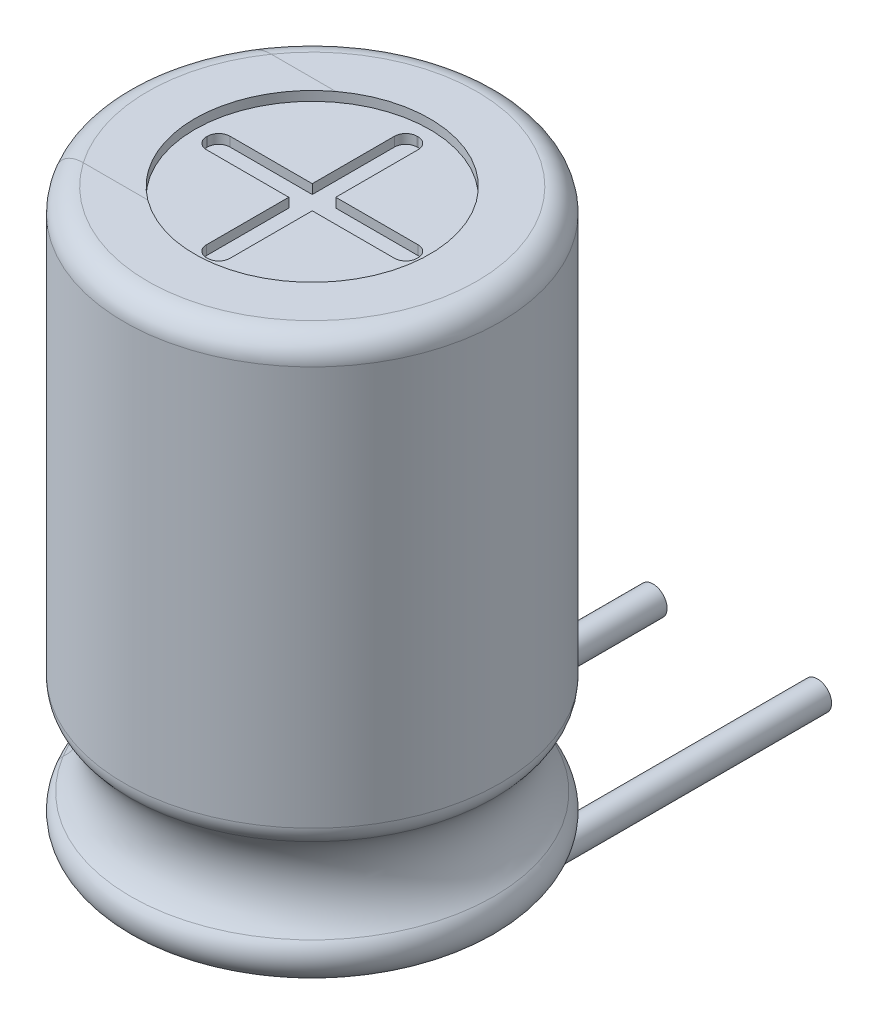
from build123d import *

# Parameters (mm, degrees)
SKETCH_3_R          = 2.5
CUT_EXTRUDE_1_DEPTH = 0.2
CUT_EXTRUDE_2_DEPTH = 0.2
CUT_EXTRUDE_START   = -0.2
SKETCH_5_R          = 2.5
CUT_EXTRUDE_3_DEPTH = 0.2
SKETCH_11_R         = 0.3


with BuildPart() as part:
    # Эскиз2 → Повернуть1 (revolve)
    with BuildSketch(Plane.XY):
        with BuildLine():
            Line((0, 0), (3.5, 0))
            ThreePointArc((3.5, 0), (3.853553391, 0.146446609), (4, 0.5))
            ThreePointArc((4, 0.5), (3.964238345, 0.685695338), (3.862068966, 0.844827586))
            ThreePointArc((3.862068966, 0.844827586), (3.5, 1.75), (3.862068966, 2.655172414))
            ThreePointArc((3.862068966, 2.655172414), (3.964238345, 2.814304662), (4, 3))
            Line((4, 3), (4, 11.5))
            ThreePointArc((4, 11.5), (3.853553391, 11.853553391), (3.5, 12))
            Line((3.5, 12), (0, 12))
            Line((0, 12), (0, 0))
        make_face()
    revolve(axis=Axis((0, 0, 0), (0, 1, 0)))

    # Эскиз3 → Вырез-Вытянуть1 (cut)
    with BuildSketch(Plane(origin=(0, 12, 0), x_dir=(1, 0, 0), z_dir=(0, 1, 0))):
        with Locations(Location((0, 0, 0), (0, 0, 180))):
            Circle(SKETCH_3_R)
    extrude(amount=-CUT_EXTRUDE_1_DEPTH, mode=Mode.SUBTRACT)

    # Эскиз4 → Вырез-Вытянуть2 (cut)
    with BuildSketch(Plane(origin=(0, 11.8, 0), x_dir=(1, 0, 0), z_dir=(0, 1, 0))):
        with BuildLine():
            Line((-0.25, -0.25), (-0.25, -2))
            ThreePointArc((-0.25, -2), (-0.179705627, -2.169705627), (-0.01, -2.24))
            Line((-0.01, -2.24), (0.01, -2.24))
            ThreePointArc((0.01, -2.24), (0.179705627, -2.169705627), (0.25, -2))
            Line((0.25, -2), (0.25, -0.25))
            Line((0.25, -0.25), (2, -0.25))
            ThreePointArc((2, -0.25), (2.169705627, -0.179705627), (2.24, -0.01))
            Line((2.24, -0.01), (2.24, 0.01))
            ThreePointArc((2.24, 0.01), (2.169705627, 0.179705627), (2, 0.25))
            Line((2, 0.25), (0.25, 0.25))
            Line((0.25, 0.25), (0.25, 2))
            ThreePointArc((0.25, 2), (0.179705627, 2.169705627), (0.01, 2.24))
            Line((0.01, 2.24), (-0.01, 2.24))
            ThreePointArc((-0.01, 2.24), (-0.179705627, 2.169705627), (-0.25, 2))
            Line((-0.25, 2), (-0.25, 0.25))
            Line((-0.25, 0.25), (-2, 0.25))
            ThreePointArc((-2, 0.25), (-2.169705627, 0.179705627), (-2.24, 0.01))
            Line((-2.24, 0.01), (-2.24, -0.01))
            ThreePointArc((-2.24, -0.01), (-2.169705627, -0.179705627), (-2, -0.25))
            Line((-2, -0.25), (-0.25, -0.25))
        make_face()
    extrude(amount=-CUT_EXTRUDE_2_DEPTH, mode=Mode.SUBTRACT)

    # Эскиз5 → Вырез-Вытянуть3 (cut)
    with BuildSketch(Plane.XZ.offset(CUT_EXTRUDE_START)):
        with Locations(Location((0, 0, 0), (0, 0, 180))):
            Circle(SKETCH_5_R)
    extrude(amount=CUT_EXTRUDE_3_DEPTH, mode=Mode.SUBTRACT)


with BuildPart() as body_2:
    # По траектории1: sweep along a path in Эскиз10
    with BuildLine(Plane(origin=(1.75, 0, 0), x_dir=(0, 0, -1), z_dir=(1, 0, 0))) as sweep_1_path:
        Line((0, 0.2), (0, 0))
        ThreePointArc((0, 0), (0.292893219, -0.707106781), (1, -1))
        Line((1, -1), (9, -1))
    # Эскиз11 → По траектории1 (sweep)
    with BuildSketch(Plane.XZ.offset(-0.2)):
        with Locations((1.75, 0)):
            Circle(SKETCH_11_R)
    sweep(path=sweep_1_path.line)


with BuildPart() as body_3:
    # Зеркальное отражение1: mirrored copy
    add(body_2.part.mirror(Plane(origin=(0, 0, 0), x_dir=(0, 0, 1), z_dir=(1, 0, 0))))


solid = Compound([part.part, body_2.part, body_3.part])
